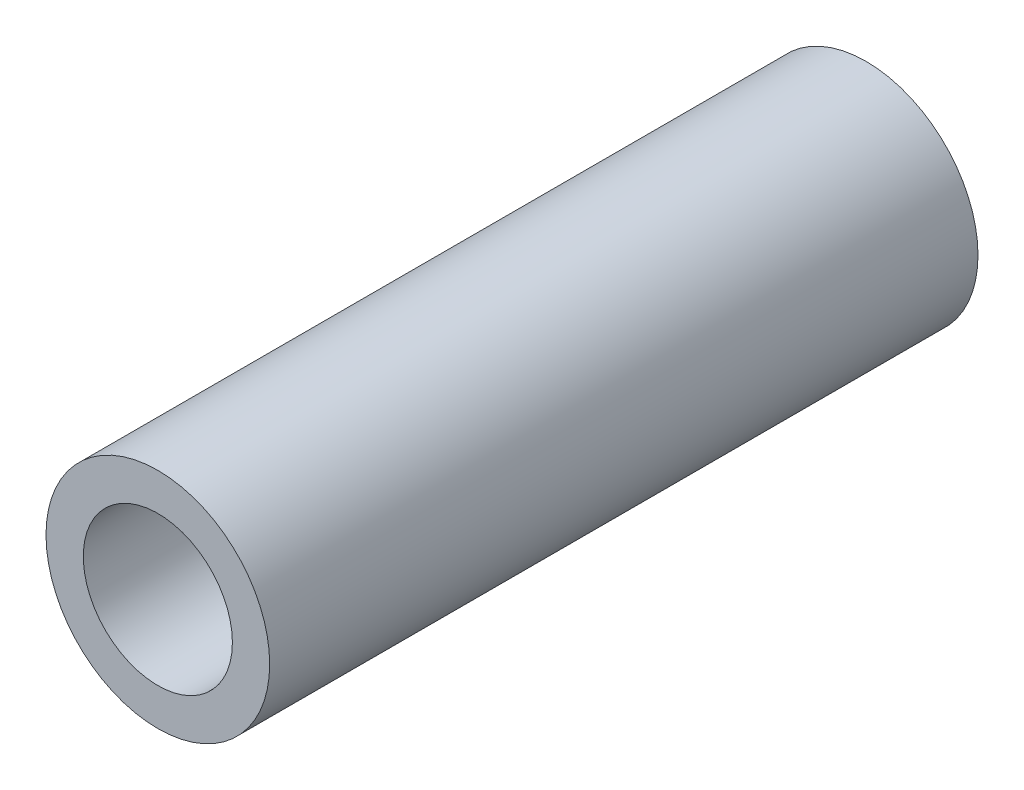
from build123d import *

# Parameters (mm, degrees)
SKETCH1_R           = 3
SKETCH1_R_2         = 2
BOSS_EXTRUDE1_DEPTH = 19


with BuildPart() as part:
    # Sketch1 → Boss-Extrude1 (new body)
    with BuildSketch(Plane.XY):
        Circle(SKETCH1_R)
        Circle(SKETCH1_R_2, mode=Mode.SUBTRACT)
    extrude(amount=BOSS_EXTRUDE1_DEPTH)


solid = part.part
